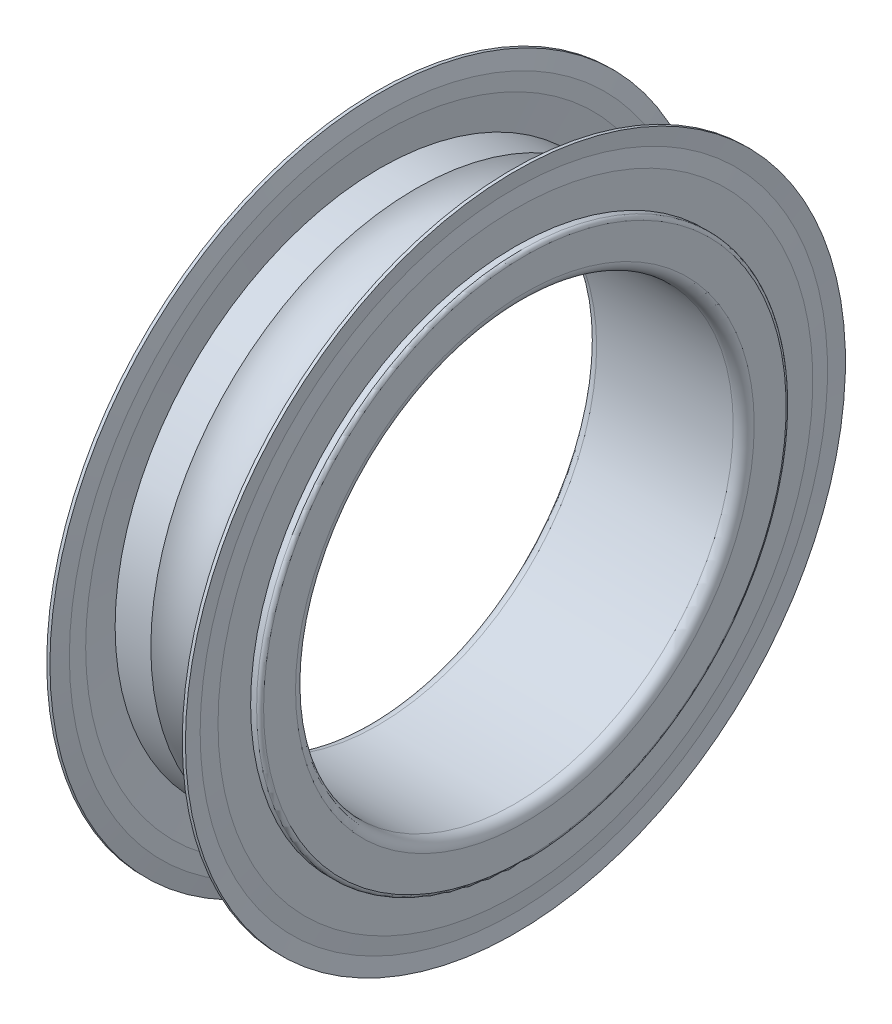
from build123d import *


with BuildPart() as part:
    # Sketch1 → Revolve1 (revolve)
    with BuildSketch(Plane.XY, mode=Mode.PRIVATE) as revolve1_sk:
        with BuildLine():
            Line((0, 14.925), (0, 13.1))
            ThreePointArc((0, 13.1), (0.175735931, 12.675735931), (0.6, 12.5))
            Line((0.6, 12.5), (8.4, 12.5))
            ThreePointArc((8.4, 12.5), (8.824264069, 12.675735931), (9, 13.1))
            Line((9, 13.1), (9, 14.925))
            ThreePointArc((9, 14.925), (8.941421356, 15.066421356), (8.8, 15.125))
            Line((8.8, 15.125), (6.240268945, 15.125))
            ThreePointArc((6.240268945, 15.125), (4.5, 14.369), (2.759731055, 15.125))
            Line((2.759731055, 15.125), (0.2, 15.125))
            ThreePointArc((0.2, 15.125), (0.058578644, 15.066421356), (0, 14.925))
        make_face()
    revolve(revolve1_sk.sketch.rotate(Axis((50, 0, 0), (-1, 0, 0)), 270), axis=Axis((50, 0, 0), (-1, 0, 0)))

    # Sketch2 → Revolve2 (revolve)
    with BuildSketch(Plane.XY, mode=Mode.PRIVATE) as revolve2_sk:
        Polygon((0.54, 18.85), (0.63, 17.91875), (0.54, 16.9875), (0.54, 15.125), (0.72, 15.125), (0.9, 16.9875), (0.9, 17.91875), (0.72, 18.85), align=None)
    revolve(revolve2_sk.sketch.rotate(Axis((50, 0, 0), (-1, 0, 0)), 270), axis=Axis((50, 0, 0), (-1, 0, 0)))

    # Sketch3 → Revolve3 (revolve)
    with BuildSketch(Plane.XY, mode=Mode.PRIVATE) as revolve3_sk:
        Polygon((8.1, 16.9875), (8.28, 15.125), (8.46, 15.125), (8.46, 16.9875), (8.37, 17.91875), (8.46, 18.85), (8.28, 18.85), (8.1, 17.91875), align=None)
    revolve(revolve3_sk.sketch.rotate(Axis((50, 0, 0), (-1, 0, 0)), 270), axis=Axis((50, 0, 0), (-1, 0, 0)))


solid = part.part
